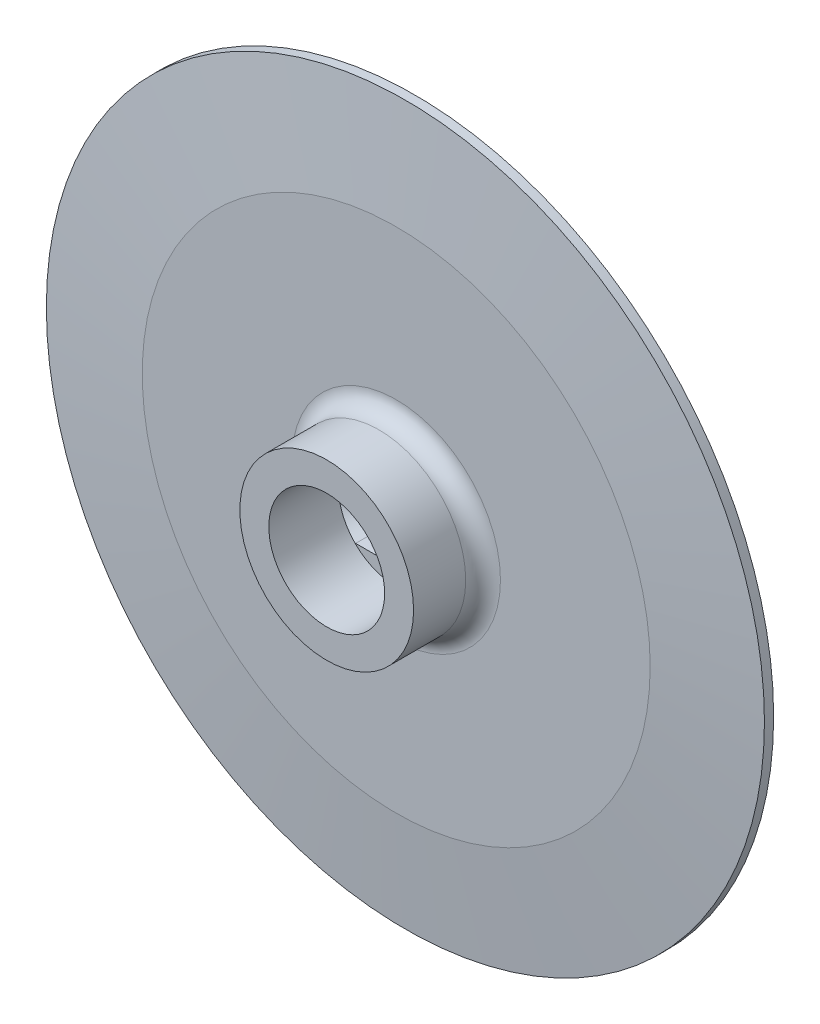
from build123d import *

# Parameters (mm, degrees)
SKETCH1_R           = 15.5
BOSS_EXTRUDE1_DEPTH = 0.396875
SKETCH2_R           = 15.5
BOSS_EXTRUDE2_DEPTH = 0.396875
BOSS_EXTRUDE2_TAPER = 85
SKETCH3_R           = 3.75
BOSS_EXTRUDE3_DEPTH = 3
FILLET1_R           = 0.75
CUT_EXTRUDE1_DEPTH  = 0.79375
SKETCH5_R           = 2.5
CUT_EXTRUDE2_DEPTH  = 3


with BuildPart() as part:
    # Sketch1 → Boss-Extrude1 (new body)
    with BuildSketch(Plane.XY):
        Circle(SKETCH1_R)
    extrude(amount=BOSS_EXTRUDE1_DEPTH)

    # Sketch2 → Boss-Extrude2 (add)
    with BuildSketch(Plane.XY.offset(0.396875)):
        Circle(SKETCH2_R)
    extrude(amount=BOSS_EXTRUDE2_DEPTH, taper=BOSS_EXTRUDE2_TAPER)

    # Sketch3 → Boss-Extrude3 (add)
    with BuildSketch(Plane.XY.offset(0.79375)):
        Circle(SKETCH3_R)
    extrude(amount=BOSS_EXTRUDE3_DEPTH)

    # Fillet1
    fillet1_edges = [part.edges().sort_by_distance(p)[0] for p in [
        (-3.75, 0, 0.79375),
    ]]
    fillet(fillet1_edges, radius=FILLET1_R)

    # Sketch4 → Cut-Extrude1 (cut)
    with BuildSketch(Plane(origin=(0, 0, 0), x_dir=(-1, 0, 0), z_dir=(0, 0, -1))):
        with BuildLine():
            Line((-1.75, 1.75), (1.75, 1.75))
            ThreePointArc((1.75, 1.75), (3.5, 0), (1.75, -1.75))
            Line((1.75, -1.75), (-1.75, -1.75))
            ThreePointArc((-1.75, -1.75), (-3.5, 0), (-1.75, 1.75))
        make_face()
    extrude(amount=-CUT_EXTRUDE1_DEPTH, mode=Mode.SUBTRACT)

    # Sketch5 → Cut-Extrude2 (cut)
    with BuildSketch(Plane.XY.offset(3.79375)):
        Circle(SKETCH5_R)
    extrude(amount=-CUT_EXTRUDE2_DEPTH, mode=Mode.SUBTRACT)


solid = part.part
